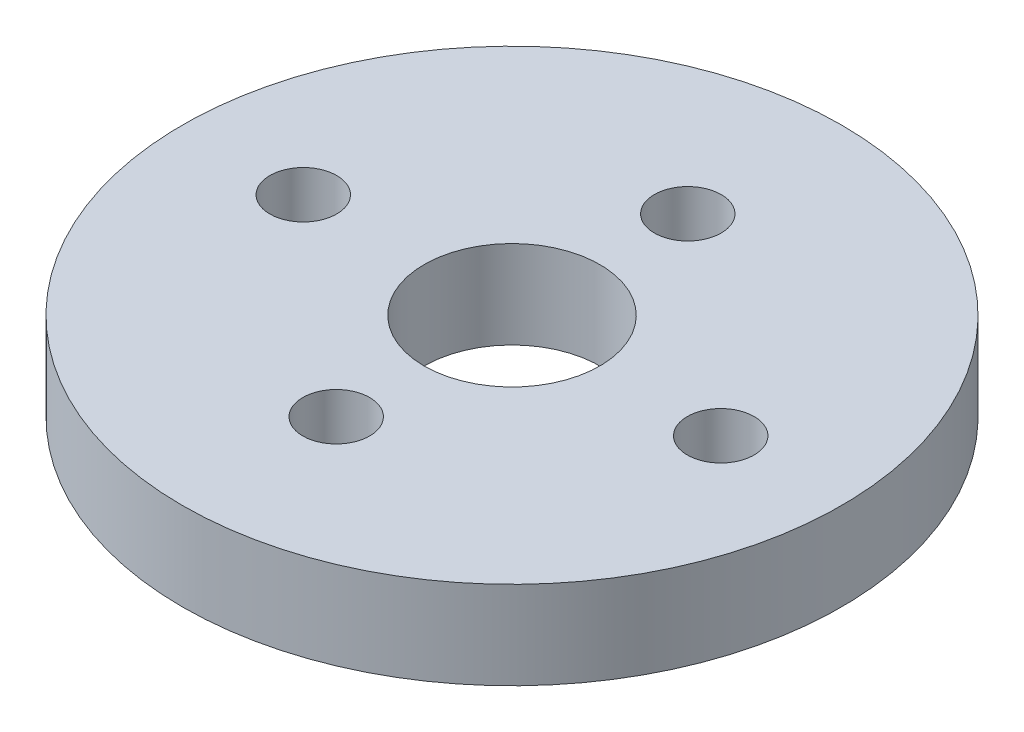
from build123d import *

# Parameters (mm, degrees)
SKETCH_1_R          = 15
EXTRUDE_1_DEPTH     = 4
SKETCH_2_R          = 1.52
SKETCH_2_R_2        = 4
CUT_EXTRUDE_1_DEPTH = 4


with BuildPart() as part:
    # 草图1 → 凸台-拉伸1 (new body)
    with BuildSketch(Plane(origin=(0, 0, 0), x_dir=(1, 0, 0), z_dir=(0, 1, 0))):
        with Locations(Location((0, 0, 0), (0, 0, 270))):
            Circle(SKETCH_1_R)
    extrude(amount=EXTRUDE_1_DEPTH)

    # 草图2 → 切除-拉伸1 (cut)
    with BuildSketch(Plane(origin=(0, 4, 0), x_dir=(1, 0, 0), z_dir=(0, 1, 0))):
        with Locations(Location((-9.5, 0, 0), (0, 0, 270))):
            Circle(SKETCH_2_R)
        with Locations(Location((0, -8, 0), (0, 0, 270))):
            Circle(SKETCH_2_R)
        with Locations(Location((9.5, 0, 0), (0, 0, 90))):
            Circle(SKETCH_2_R)
        with Locations(Location((0, 8, 0), (0, 0, 90))):
            Circle(SKETCH_2_R)
        with Locations(Location((0, 0, 0), (0, 0, 270))):
            Circle(SKETCH_2_R_2)
    extrude(amount=-CUT_EXTRUDE_1_DEPTH, mode=Mode.SUBTRACT)


solid = part.part
